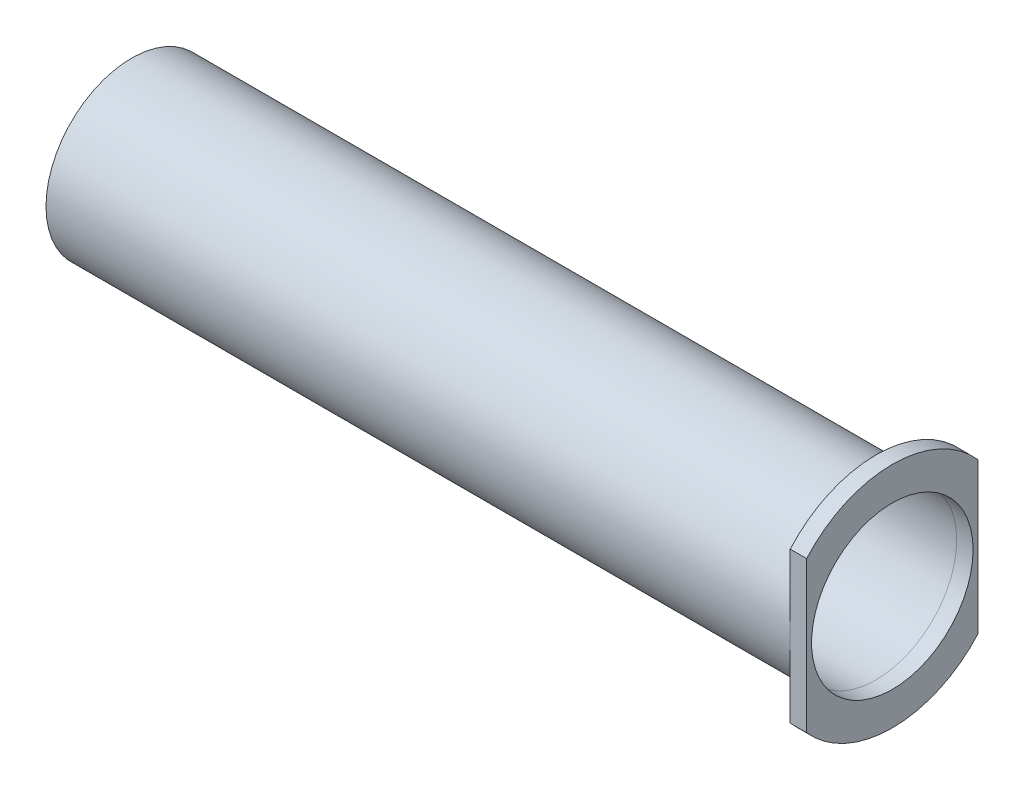
from build123d import *

# Parameters (mm, degrees)
CUT_EXTRUDE1_DEPTH      = 45
CUT_EXTRUDE1_DEPTH_BACK = 260
SKETCH2_R               = 3.75
SKETCH3_R               = 16.5
CUT_EXTRUDE2_DEPTH      = 149
SKETCH4_R               = 16.5
BOSS_EXTRUDE1_DEPTH     = 3.35


with BuildPart() as part:
    # Sketch1 → Revolve2 (revolve)
    with BuildSketch(Plane.XY, mode=Mode.PRIVATE) as revolve2_sk:
        Polygon((0, 0), (157, 0), (157, 17.5), (5, 17.5), (5, 4.75), (0, 4.75), align=None)
    revolve(revolve2_sk.sketch.rotate(Axis((0, 0, 0), (1, 0, 0)), 90), axis=Axis((0, 0, 0), (1, 0, 0)))

    # Sketch2 → Cut-Extrude1 (cut, two sides: drawn at the far end of the back side and taken through both)
    with BuildSketch(Plane.ZY.offset(-CUT_EXTRUDE1_DEPTH_BACK)):
        with Locations(Location((0, 0, 0), (0, 0, 180))):
            Circle(SKETCH2_R)
    extrude(amount=CUT_EXTRUDE1_DEPTH + CUT_EXTRUDE1_DEPTH_BACK, mode=Mode.SUBTRACT)

    # Sketch3 → Cut-Extrude2 (cut)
    with BuildSketch(Plane(origin=(157, 0, 0), x_dir=(0, 0, -1), z_dir=(1, 0, 0))):
        Circle(SKETCH3_R)
    extrude(amount=-CUT_EXTRUDE2_DEPTH, mode=Mode.SUBTRACT)


with BuildPart() as body_2:
    # Sketch4 → Boss-Extrude1 (new body)
    with BuildSketch(Plane(origin=(157, 0, 0), x_dir=(0, 0, -1), z_dir=(1, 0, 0))):
        with BuildLine():
            Line((-17.5, 15.398249901), (-17.5, -15.398249901))
            ThreePointArc((-17.5, -15.398249901), (0, -23.31), (17.5, -15.398249901))
            Line((17.5, -15.398249901), (17.5, 15.398249901))
            ThreePointArc((17.5, 15.398249901), (0, 23.31), (-17.5, 15.398249901))
        make_face()
        Circle(SKETCH4_R, mode=Mode.SUBTRACT)
    extrude(amount=BOSS_EXTRUDE1_DEPTH)


solid = Compound([part.part, body_2.part])
